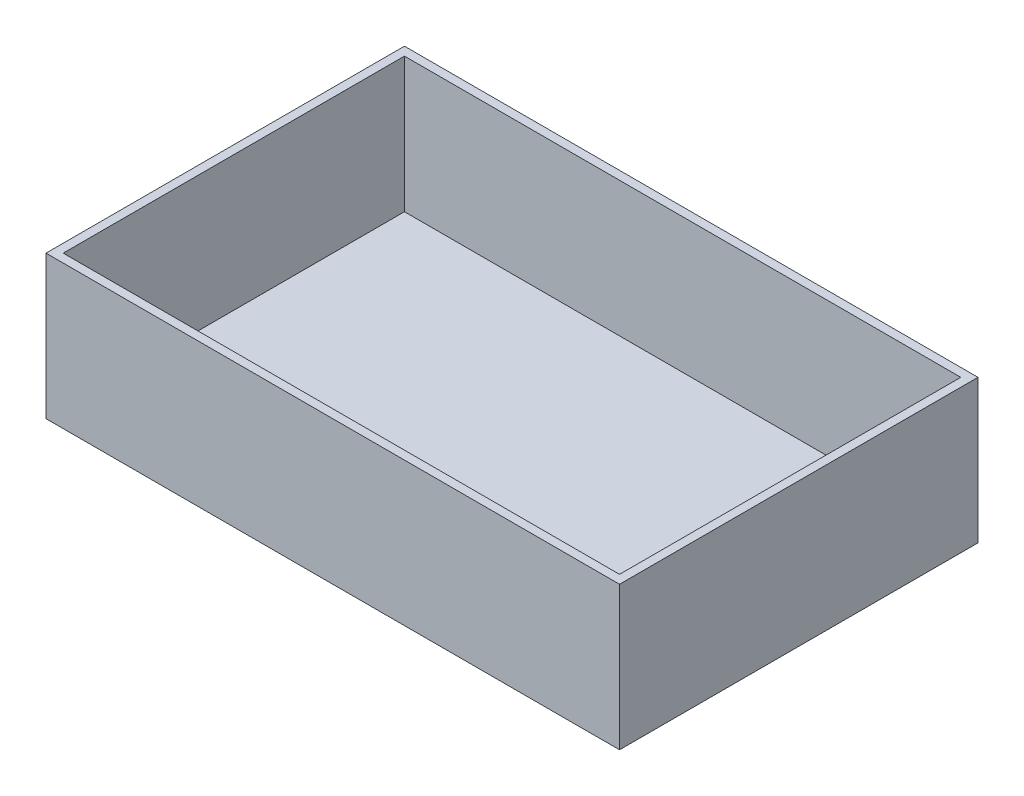
from build123d import *

# Parameters (mm, degrees)
SKETCH1_W           = 388
SKETCH1_H           = 238
BOSS_EXTRUDE1_DEPTH = 6
SKETCH1_3_W         = 400
SKETCH1_3_H         = 250
SKETCH1_3_W_2       = 388
SKETCH1_3_H_2       = 238
BOSS_EXTRUDE2_DEPTH = 100


with BuildPart() as part:
    # Sketch1 → Boss-Extrude1 (new body)
    with BuildSketch(Plane(origin=(0, 0, 0), x_dir=(1, 0, 0), z_dir=(0, 1, 0))):
        Rectangle(SKETCH1_W, SKETCH1_H)
    extrude(amount=BOSS_EXTRUDE1_DEPTH)

    # Sketch1<3> → Boss-Extrude2 (add)
    with BuildSketch(Plane(origin=(0, 0, 0), x_dir=(1, 0, 0), z_dir=(0, 1, 0))):
        Rectangle(SKETCH1_3_W, SKETCH1_3_H)
        Rectangle(SKETCH1_3_W_2, SKETCH1_3_H_2, mode=Mode.SUBTRACT)
    extrude(amount=BOSS_EXTRUDE2_DEPTH)


solid = part.part
